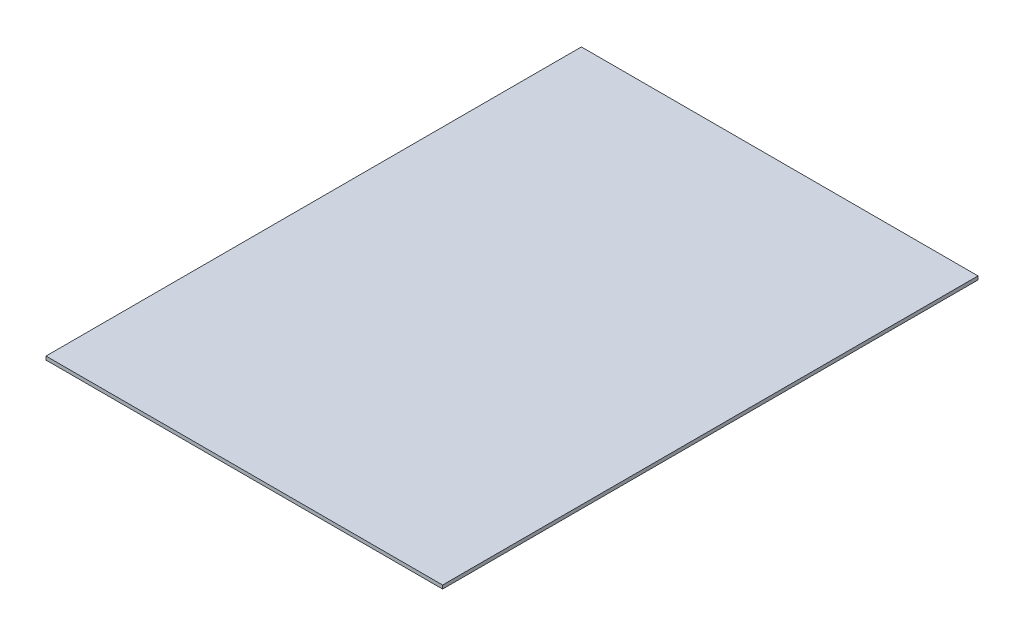
from build123d import *

# Parameters (mm, degrees)
SKETCH1_W           = 177.8
SKETCH1_H           = 240.03
BOSS_EXTRUDE1_DEPTH = 1.5875


with BuildPart() as part:
    # Sketch1 → Boss-Extrude1 (new body)
    with BuildSketch(Plane(origin=(0, 0, 0), x_dir=(1, 0, 0), z_dir=(0, 1, 0))):
        Rectangle(SKETCH1_W, SKETCH1_H)
    extrude(amount=BOSS_EXTRUDE1_DEPTH)


solid = part.part
